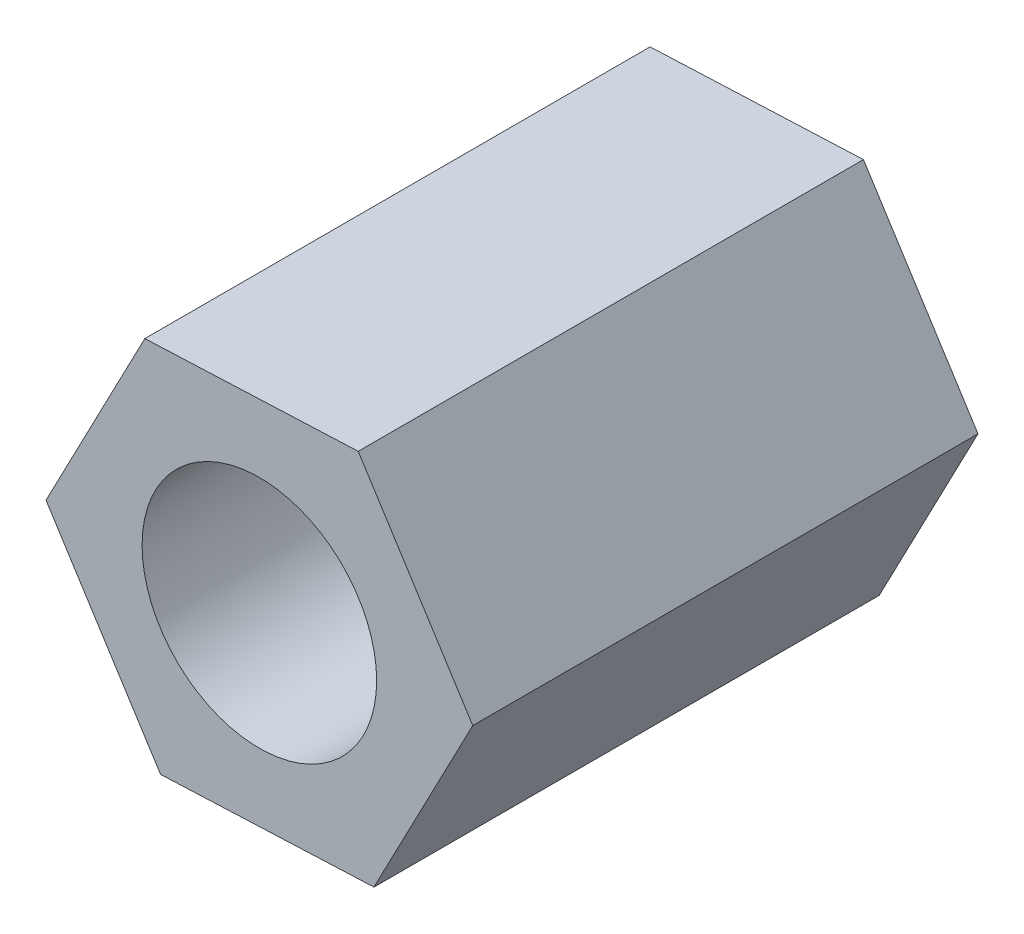
from build123d import *

# Parameters (mm, degrees)
EXTRUDE_1_DEPTH     = 56
SKETCH_2_R          = 13
CUT_EXTRUDE_1_DEPTH = 27
SKETCH_3_R          = 11.1
CUT_EXTRUDE_2_DEPTH = 43.902904642


with BuildPart() as part:
    # 草图1 → 凸台-拉伸1 (new body)
    with BuildSketch(Plane.XY):
        Polygon((-12.695703738, 19.978799762), (-23.65, -1.005402075), (-10.954296262, -20.984201837), (12.695703738, -19.978799762), (23.65, 1.005402075), (10.954296262, 20.984201837), align=None)
    extrude(amount=EXTRUDE_1_DEPTH)

    # 草图2 → 切除-拉伸1 (cut)
    with BuildSketch(Plane.XY.offset(56)):
        Circle(SKETCH_2_R)
    extrude(amount=-CUT_EXTRUDE_1_DEPTH, mode=Mode.SUBTRACT)

    # 草图3 → 切除-拉伸2 (cut, through all)
    with BuildSketch(Plane.XY.offset(29)):
        Circle(SKETCH_3_R)
    extrude(amount=-CUT_EXTRUDE_2_DEPTH, mode=Mode.SUBTRACT)


solid = part.part
